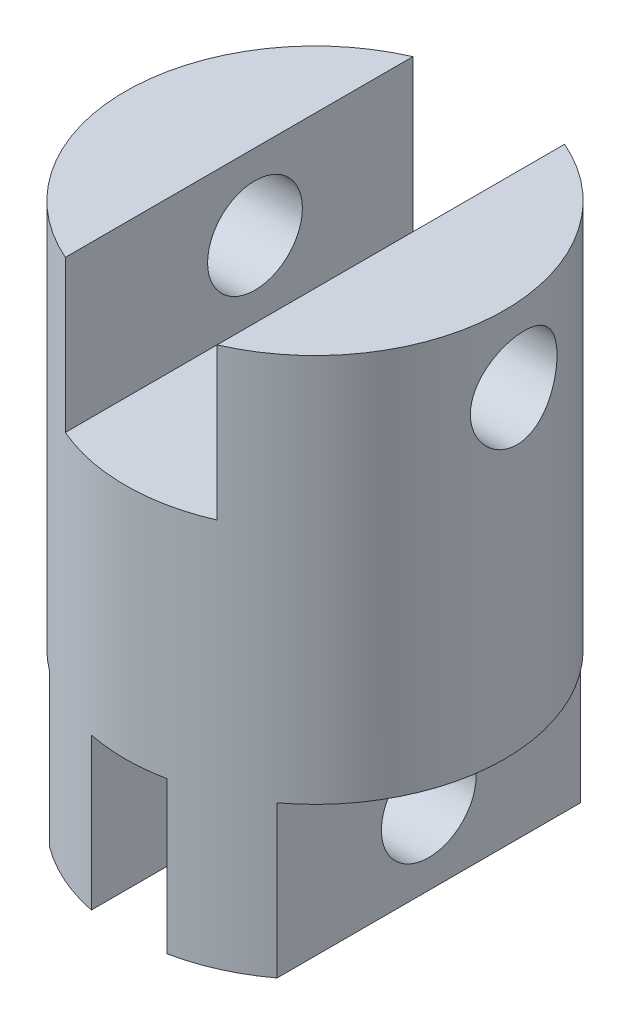
from build123d import *

# Parameters (mm, degrees)
SKETCH1_R               = 12.7
BOSS_EXTRUDE1_DEPTH     = 36.195
CUT_EXTRUDE1_START      = -10.16
CUT_EXTRUDE1_DEPTH      = 10.16
CUT_EXTRUDE2_DEPTH      = 10.16
CUT_EXTRUDE3_DEPTH      = 43.278794034
CUT_EXTRUDE3_DEPTH_BACK = 43.278794034
SKETCH4_R               = 3.175
SKETCH5_R               = 2.54
CUT_EXTRUDE4_DEPTH      = 32.629120053


with BuildPart() as part:
    # Sketch1 → Boss-Extrude1 (new body)
    with BuildSketch(Plane(origin=(0, 0, 0), x_dir=(1, 0, 0), z_dir=(0, 1, 0))):
        with Locations(Location((0, 0, 0), (0, 0, 270))):
            Circle(SKETCH1_R)
    extrude(amount=BOSS_EXTRUDE1_DEPTH)

    # Sketch2 → Cut-Extrude1 (cut)
    with BuildSketch(Plane(origin=(0, 36.195, 0), x_dir=(1, 0, 0), z_dir=(0, 1, 0)).offset(CUT_EXTRUDE1_START)):
        with BuildLine():
            Line((5.08, 11.639742265), (5.08, -11.639742265))
            ThreePointArc((5.08, -11.639742265), (0, -12.7), (-5.08, -11.639742265))
            Line((-5.08, -11.639742265), (-5.08, 11.639742265))
            ThreePointArc((-5.08, 11.639742265), (0, 12.7), (5.08, 11.639742265))
        make_face()
    extrude(amount=CUT_EXTRUDE1_DEPTH, mode=Mode.SUBTRACT)

    # Sketch3 → Cut-Extrude2 (cut)
    with BuildSketch(Plane.XZ):
        with BuildLine():
            Line((-2.54, 12.443407893), (-2.54, -12.443407893))
            ThreePointArc((-2.54, -12.443407893), (0, -12.7), (2.54, -12.443407893))
            Line((2.54, -12.443407893), (2.54, 12.443407893))
            ThreePointArc((2.54, 12.443407893), (0, 12.7), (-2.54, 12.443407893))
        make_face()
        with BuildLine():
            Line((-7.62, 10.16), (-7.62, -10.16))
            ThreePointArc((-7.62, -10.16), (-12.7, 0), (-7.62, 10.16))
        make_face()
        with BuildLine():
            Line((7.62, 10.16), (7.62, -10.16))
            ThreePointArc((7.62, -10.16), (12.7, 0), (7.62, 10.16))
        make_face()
    extrude(amount=-CUT_EXTRUDE2_DEPTH, mode=Mode.SUBTRACT)

    # Sketch4 → Cut-Extrude3 (cut, two sides: drawn at the far end of the back side and taken through both)
    with BuildSketch(Plane(origin=(-5.08, 0, 0), x_dir=(0, 0, -1), z_dir=(1, 0, 0)).offset(-CUT_EXTRUDE3_DEPTH_BACK)):
        with Locations((1.060257735, 31.115)):
            Circle(SKETCH4_R)
        with Locations((0, 5.08)):
            Circle(SKETCH4_R)
    extrude(amount=CUT_EXTRUDE3_DEPTH + CUT_EXTRUDE3_DEPTH_BACK, mode=Mode.SUBTRACT)

    # Sketch5 → Cut-Extrude4 (cut, through all)
    with BuildSketch(Plane(origin=(0, 26.035, 0), x_dir=(1, 0, 0), z_dir=(0, 1, 0))):
        with Locations(Location((0, 0, 0), (0, 0, 270))):
            Circle(SKETCH5_R)
    extrude(amount=-CUT_EXTRUDE4_DEPTH, mode=Mode.SUBTRACT)


solid = part.part
